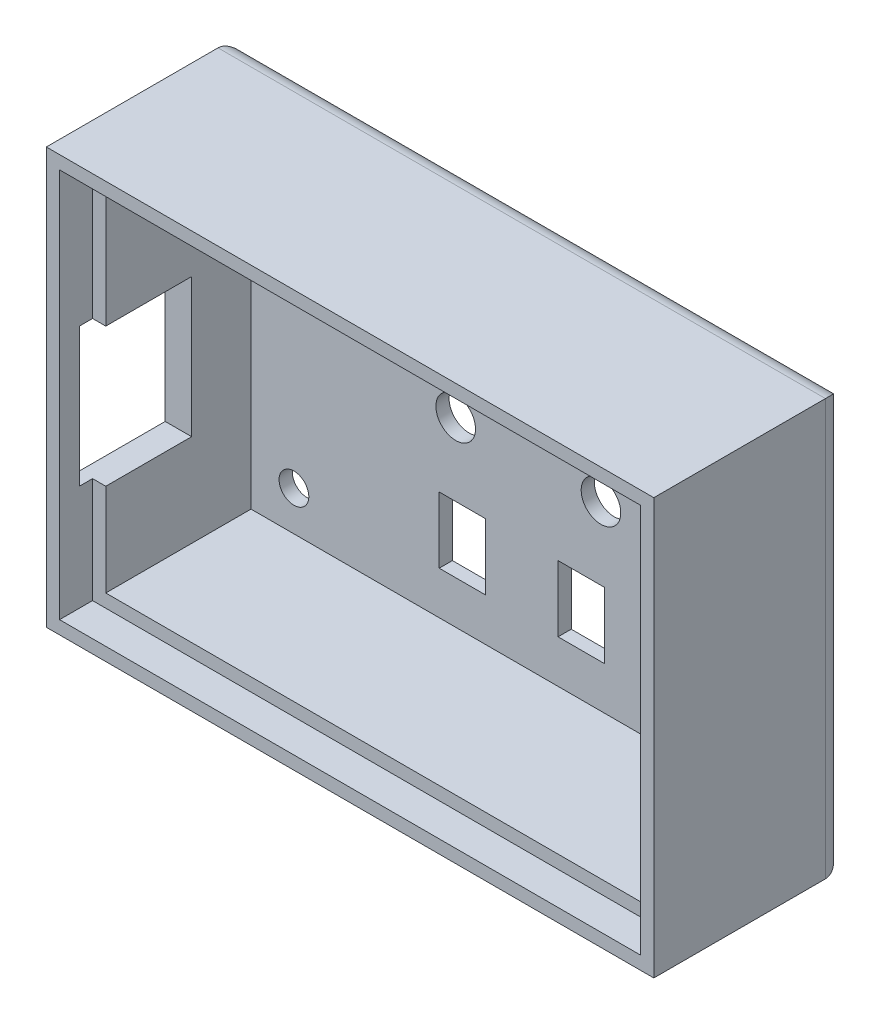
from build123d import *

# Parameters (mm, degrees)
SKETCH3_W           = 92
SKETCH3_H           = 63
SKETCH3_R           = 3
SKETCH3_R_2         = 2.25
SKETCH3_W_2         = 7
SKETCH3_H_2         = 10
BOSS_EXTRUDE3_DEPTH = 29
SKETCH4_W           = 84
SKETCH4_H           = 55
CUT_EXTRUDE1_DEPTH  = 27
SKETCH5_W           = 88
SKETCH5_H           = 59
CUT_EXTRUDE2_DEPTH  = 5
FILLET1_R           = 3
SKETCH6_W           = 15
SKETCH6_H           = 21
CUT_EXTRUDE3_DEPTH  = 5


with BuildPart() as part:
    # Sketch3 → Boss-Extrude3 (new body)
    with BuildSketch(Plane.XY):
        with Locations((46, 31.5)):
            Rectangle(SKETCH3_W, SKETCH3_H)
        with Locations(Location((35, 31.5, 0), (0, 0, 180))):
            Circle(SKETCH3_R, mode=Mode.SUBTRACT)
        with Locations(Location((57, 31.5, 0), (0, 0, 180))):
            Circle(SKETCH3_R, mode=Mode.SUBTRACT)
        with Locations(Location((77, 31.5, 0), (0, 0, 180))):
            Circle(SKETCH3_R, mode=Mode.SUBTRACT)
        with Locations(Location((82, 53, 0), (0, 0, 180))):
            Circle(SKETCH3_R_2, mode=Mode.SUBTRACT)
        with Locations(Location((82, 10, 0), (0, 0, 180))):
            Circle(SKETCH3_R_2, mode=Mode.SUBTRACT)
        with Locations(Location((10.5, 10, 0), (0, 0, 180))):
            Circle(SKETCH3_R_2, mode=Mode.SUBTRACT)
        with Locations(Location((10.5, 53, 0), (0, 0, 180))):
            Circle(SKETCH3_R_2, mode=Mode.SUBTRACT)
        with Locations((71.5, 15.5)):
            Rectangle(SKETCH3_W_2, SKETCH3_H_2, mode=Mode.SUBTRACT)
        with Locations((54, 15.5)):
            Rectangle(SKETCH3_W_2, SKETCH3_H_2, mode=Mode.SUBTRACT)
        with Locations((36, 15.5)):
            Rectangle(SKETCH3_W_2, SKETCH3_H_2, mode=Mode.SUBTRACT)
    extrude(amount=BOSS_EXTRUDE3_DEPTH)

    # Sketch4 → Cut-Extrude1 (cut)
    with BuildSketch(Plane.XY.offset(29)):
        with Locations((46, 31.5)):
            Rectangle(SKETCH4_W, SKETCH4_H)
    extrude(amount=-CUT_EXTRUDE1_DEPTH, mode=Mode.SUBTRACT)

    # Sketch5 → Cut-Extrude2 (cut)
    with BuildSketch(Plane.XY.offset(29)):
        with Locations((46, 31.5)):
            Rectangle(SKETCH5_W, SKETCH5_H)
    extrude(amount=-CUT_EXTRUDE2_DEPTH, mode=Mode.SUBTRACT)

    # Fillet1
    fillet1_edges = [part.edges().sort_by_distance(p)[0] for p in [
        (0, 31.5, 0),
        (46, 63, 0),
        (92, 31.5, 0),
        (46, 0, 0),
    ]]
    fillet(fillet1_edges, radius=FILLET1_R)

    # Sketch6 → Cut-Extrude3 (cut)
    with BuildSketch(Plane.ZY):
        with Locations((18.5, 28.5)):
            Rectangle(SKETCH6_W, SKETCH6_H)
    extrude(amount=-CUT_EXTRUDE3_DEPTH, mode=Mode.SUBTRACT)


solid = part.part
